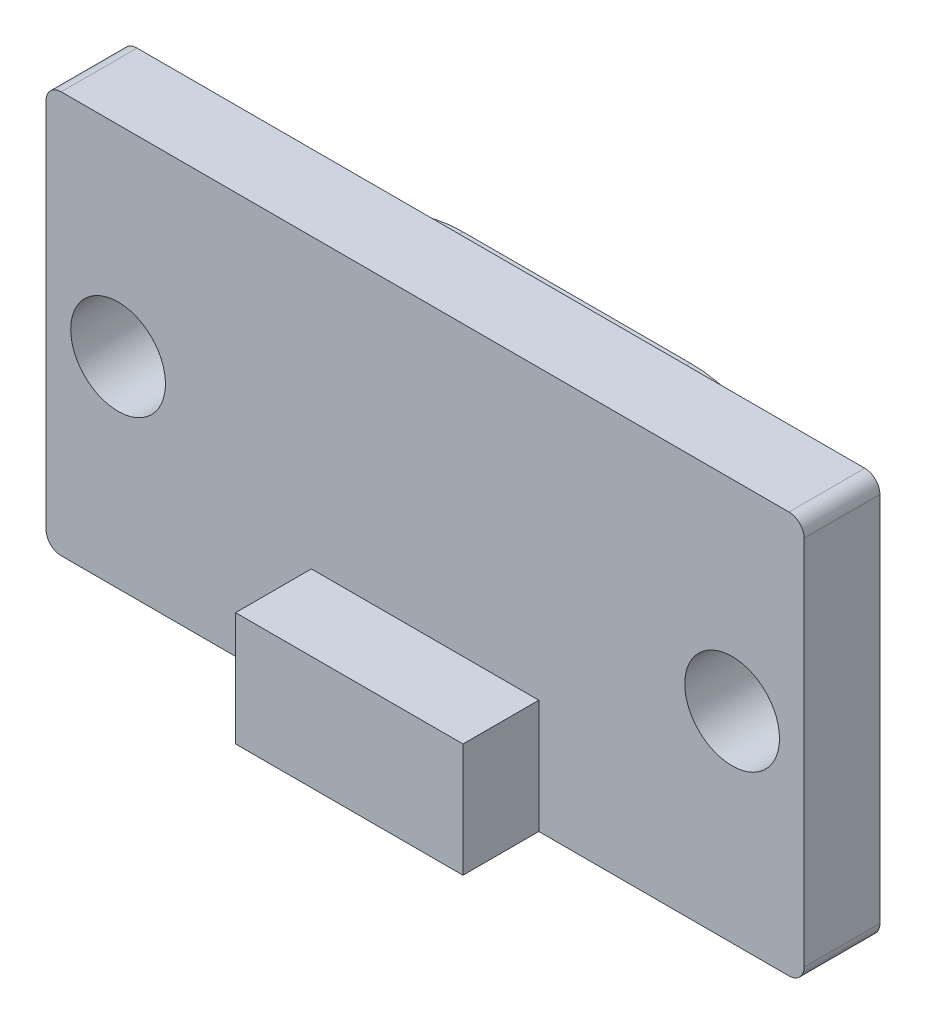
from build123d import *

# Parameters (mm, degrees)
SKETCH_1_W      = 20
SKETCH_1_H      = 10.6
SKETCH_1_R      = 1.25
EXTRUDE_1_DEPTH = 2
EXTRUDE_2_DEPTH = 2
SKETCH_3_W      = 6
SKETCH_3_H      = 3
EXTRUDE_3_DEPTH = 2
FILLET_1_R      = 0.4


with BuildPart() as part:
    # 草图1 → 凸台-拉伸1 (new body)
    with BuildSketch(Plane.XY):
        Rectangle(SKETCH_1_W, SKETCH_1_H)
        with Locations((8.1, 0)):
            Circle(SKETCH_1_R, mode=Mode.SUBTRACT)
        with Locations(Location((-8.1, 0, 0), (0, 0, 180))):
            Circle(SKETCH_1_R, mode=Mode.SUBTRACT)
    extrude(amount=EXTRUDE_1_DEPTH)

    # 草图2 → 凸台-拉伸2 (add)
    with BuildSketch(Plane(origin=(0, 0, 0), x_dir=(-1, 0, 0), z_dir=(0, 0, -1))):
        with BuildLine():
            Line((-3, 3.4), (3, 3.4))
            ThreePointArc((3, 3.4), (6.4, 0), (3, -3.4))
            Line((3, -3.4), (-3, -3.4))
            ThreePointArc((-3, -3.4), (-6.4, 0), (-3, 3.4))
        make_face()
    extrude(amount=EXTRUDE_2_DEPTH)

    # 草图3 → 凸台-拉伸3 (add)
    with BuildSketch(Plane.XY.offset(2)):
        with Locations((0, -3.8)):
            Rectangle(SKETCH_3_W, SKETCH_3_H)
    extrude(amount=EXTRUDE_3_DEPTH)

    # 圆角1
    fillet_1_edges = [part.edges().sort_by_distance(p)[0] for p in [
        (10, -5.3, 1),
        (-10, -5.3, 1),
        (-10, 5.3, 1),
        (10, 5.3, 1),
    ]]
    fillet(fillet_1_edges, radius=FILLET_1_R)


solid = part.part
